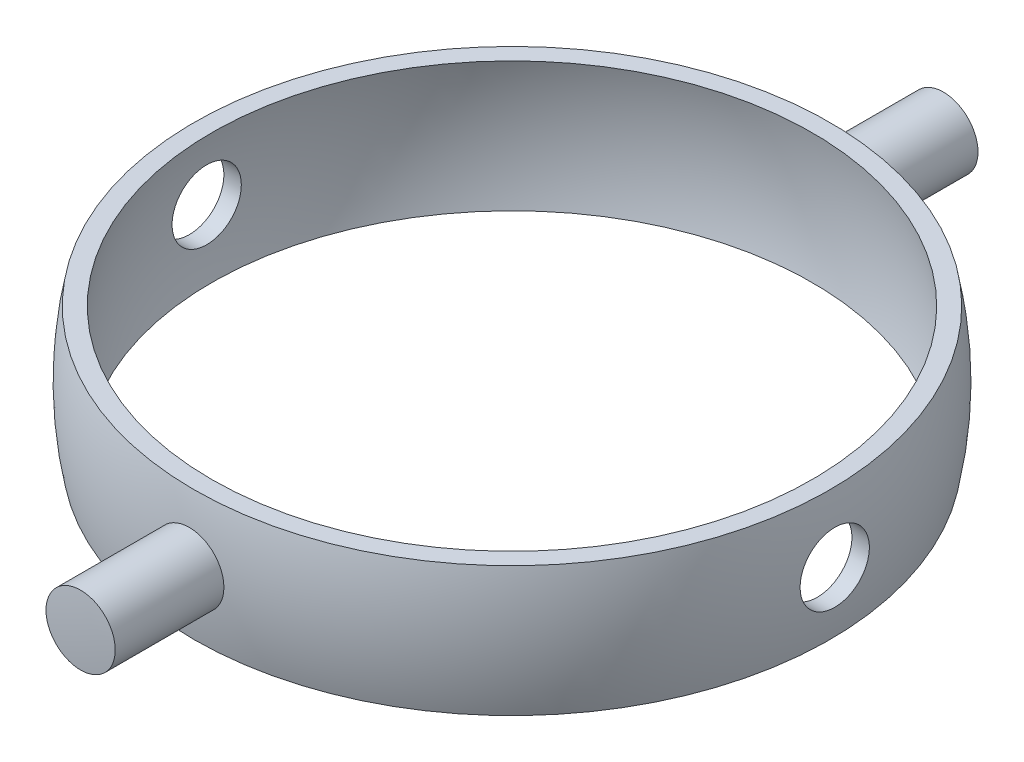
from build123d import *

# Parameters (mm, degrees)
CUT_EXTRUDE1_DEPTH       = 54.560713214
CUT_EXTRUDE1_DEPTH_BACK  = 54.560713214
SKETCH2_R                = 4
BOSS_EXTRUDE1_REACH      = 97.408
BOSS_EXTRUDE1_END_RADIUS = 37.5
SKETCH3_R                = 4


with BuildPart() as part:
    # Sketch1 → Revolve1 (revolve)
    with BuildSketch(Plane.XY):
        with BuildLine():
            Line((-36.742346142, 7.5), (-34.698703146, 7.5))
            ThreePointArc((-34.698703146, 7.5), (-35.5, 0), (-34.698703146, -7.5))
            Line((-34.698703146, -7.5), (-36.742346142, -7.5))
            ThreePointArc((-36.742346142, -7.5), (-37.5, 0), (-36.742346142, 7.5))
        make_face()
    revolve(axis=Axis((0, 11.247868895, 0), (0, -1, 0)))

    # Sketch2 → Cut-Extrude1 (cut, two sides: drawn at the far end of the back side and taken through both)
    with BuildSketch(Plane(origin=(0, 0, 0), x_dir=(0, 0, -1), z_dir=(1, 0, 0)).offset(-CUT_EXTRUDE1_DEPTH_BACK)):
        Circle(SKETCH2_R)
    extrude(amount=CUT_EXTRUDE1_DEPTH + CUT_EXTRUDE1_DEPTH_BACK, mode=Mode.SUBTRACT)

    # Boss-Extrude1: up to this sphere (the profile starts outside it)
    boss_extrude1_end = Location((0, 0, 0)) * Sphere(BOSS_EXTRUDE1_END_RADIUS, mode=Mode.PRIVATE)
    # Sketch3 → Boss-Extrude1 (add, up to the surface)
    with BuildSketch(Plane.XY.offset(50), mode=Mode.PRIVATE) as boss_extrude1_sk1:
        Circle(SKETCH3_R)
    boss_extrude1_tool1 = extrude(boss_extrude1_sk1.sketch, amount=-BOSS_EXTRUDE1_REACH, mode=Mode.PRIVATE) - boss_extrude1_end
    boss_extrude1 = boss_extrude1_tool1.solids().sort_by_distance((0, 0, 50))[0]
    add(boss_extrude1)

    # Mirror1: Boss-Extrude1 across plane
    add(boss_extrude1.mirror(Plane.XY))

    # Sketch4 → Cut-Revolve1 (revolve, cut)
    with BuildSketch(Plane(origin=(0, 0, 0), x_dir=(0, 0, -1), z_dir=(1, 0, 0))):
        with BuildLine():
            Line((0, 55), (0, 50))
            ThreePointArc((0, 50), (-26.344346123, 42.496769611), (-44.781984309, 22.239017095))
            ThreePointArc((-44.781984309, 22.239017095), (-49.936147098, -2.526106298), (-42.309118467, -26.644671035))
            ThreePointArc((-42.309118467, -26.644671035), (-24.163675717, -43.773471143), (0, -50))
            Line((0, -50), (0, -55))
            ThreePointArc((0, -55), (-26.662269282, -48.105336469), (-46.63990672, -29.1499417))
            ThreePointArc((-46.63990672, -29.1499417), (-54.954882223, -2.227312238), (-48.845939811, 25.279916218))
            ThreePointArc((-48.845939811, 25.279916218), (-28.588499506, 46.98614366), (0, 55))
        make_face()
    revolve(axis=Axis((0, 23.225288386, 0), (0, -1, 0)), mode=Mode.SUBTRACT)


solid = part.part
